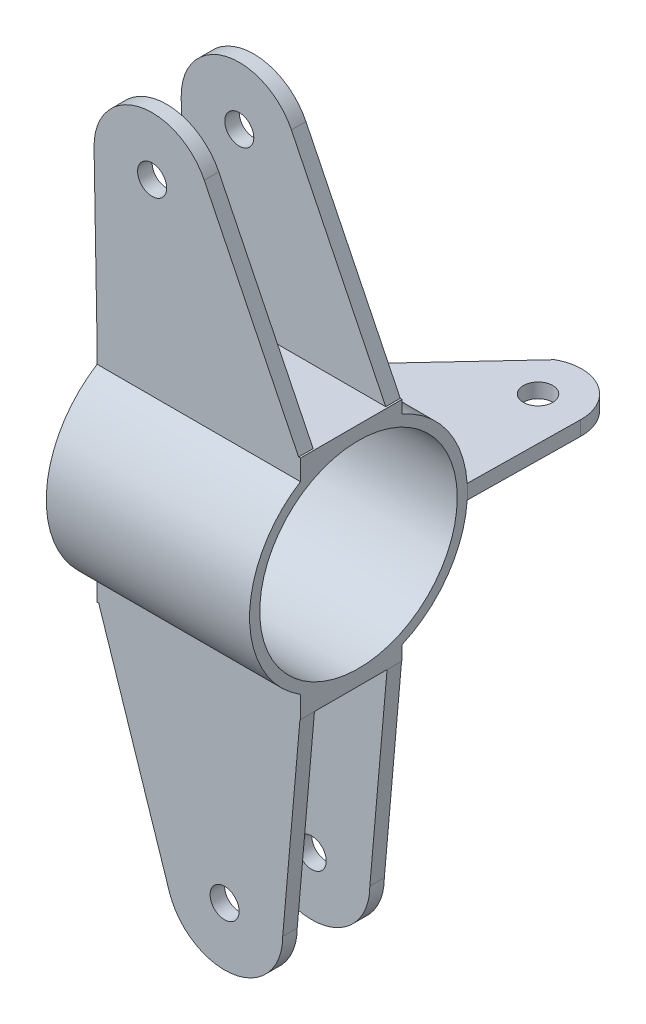
from build123d import *

# Parameters (mm, degrees)
SKETCH1_R             = 37.5
SKETCH1_R_2           = 34
BOSS_EXTRUDE1_DEPTH   = 35
BOSS_EXTRUDE2_START   = 15
SKETCH2_R             = 5
BOSS_EXTRUDE2_DEPTH   = 5
BOSS_EXTRUDE2_2_DEPTH = 5
BOSS_EXTRUDE3_START   = -15
SKETCH2_2_R           = 5
BOSS_EXTRUDE3_DEPTH   = 5
BOSS_EXTRUDE3_2_DEPTH = 5
BOSS_EXTRUDE4_DEPTH   = 70
BOSS_EXTRUDE5_START   = -70
BOSS_EXTRUDE5_DEPTH   = 70
SKETCH5_R             = 5.05
BOSS_EXTRUDE6_DEPTH   = 2.5
SKETCH6_W             = 0.149877485
SKETCH6_H             = 5
BOSS_EXTRUDE7_DEPTH   = 70


with BuildPart() as part:
    # Sketch1 → Boss-Extrude1 (new, symmetric)
    with BuildSketch(Plane(origin=(0, 0, 0), x_dir=(0, 0, -1), z_dir=(1, 0, 0))):
        Circle(SKETCH1_R)
        Circle(SKETCH1_R_2, mode=Mode.SUBTRACT)
    extrude(amount=BOSS_EXTRUDE1_DEPTH, both=True)



with BuildPart() as body_2:
    # Sketch2 → Boss-Extrude2 (new body)
    with BuildSketch(Plane.XY.offset(BOSS_EXTRUDE2_START)):
        with BuildLine():
            Line((-36.046360502, 95.880386994), (-35, 37.5))
            Line((-35, 37.5), (35, 37.5))
            Line((35, 37.5), (1.90425986, 105.037379634))
            ThreePointArc((1.90425986, 105.037379634), (-20.743145305, 115.677666176), (-36.046360502, 95.880386994))
        make_face()
        with Locations((-16.052783226, 96.238734902)):
            Circle(SKETCH2_R, mode=Mode.SUBTRACT)
    extrude(amount=BOSS_EXTRUDE2_DEPTH)


with BuildPart() as body_3:
    # Sketch2 → Boss-Extrude2 2 (new body)
    with BuildSketch(Plane.XY.offset(BOSS_EXTRUDE2_START)):
        with BuildLine():
            Line((-35, -37.5), (35, -37.5))
            Line((35, -37.5), (28.89703955, -106.961265098))
            ThreePointArc((28.89703955, -106.961265098), (12.060917272, -126.709426475), (-10.101948226, -113.209341881))
            Line((-10.101948226, -113.209341881), (-35, -37.5))
        make_face()
        with Locations((8.89703955, -106.961265098)):
            Circle(SKETCH2_R, mode=Mode.SUBTRACT)
    extrude(amount=BOSS_EXTRUDE2_2_DEPTH)


with BuildPart() as body_4:
    # Sketch2<2> → Boss-Extrude3 (new body)
    with BuildSketch(Plane.XY.offset(BOSS_EXTRUDE3_START)):
        with BuildLine():
            Line((-36.046360502, 95.880386994), (-35, 37.5))
            Line((-35, 37.5), (35, 37.5))
            Line((35, 37.5), (1.90425986, 105.037379634))
            ThreePointArc((1.90425986, 105.037379634), (-20.743145305, 115.677666176), (-36.046360502, 95.880386994))
        make_face()
        with Locations((-16.052783226, 96.238734902)):
            Circle(SKETCH2_2_R, mode=Mode.SUBTRACT)
    extrude(amount=BOSS_EXTRUDE3_DEPTH)


with BuildPart() as body_5:
    # Sketch2<2> → Boss-Extrude3 2 (new body)
    with BuildSketch(Plane.XY.offset(BOSS_EXTRUDE3_START)):
        with BuildLine():
            Line((-35, -37.5), (35, -37.5))
            Line((35, -37.5), (28.89703955, -106.961265098))
            ThreePointArc((28.89703955, -106.961265098), (12.060917272, -126.709426475), (-10.101948226, -113.209341881))
            Line((-10.101948226, -113.209341881), (-35, -37.5))
        make_face()
        with Locations((8.89703955, -106.961265098)):
            Circle(SKETCH2_2_R, mode=Mode.SUBTRACT)
    extrude(amount=BOSS_EXTRUDE3_2_DEPTH)


with BuildPart() as part_1:
    add(part.part)

    add(body_2.part)  # Boss-Extrude4 merges body 2

    add(body_4.part)  # Boss-Extrude4 merges body 4
    # Sketch3 → Boss-Extrude4 (add)
    with BuildSketch(Plane(origin=(35, 0, 0), x_dir=(0, 0, -1), z_dir=(1, 0, 0))):
        with BuildLine():
            Line((-20, 37.5), (-20, 31.721443851))
            ThreePointArc((-20, 31.721443851), (-2.828923646, 37.393143636), (15, 34.369317712))
            Line((15, 34.369317712), (15, 37.5))
            Line((15, 37.5), (15, 38.756727822))
            Line((15, 38.756727822), (-20, 38.756727822))
            Line((-20, 38.756727822), (-20, 37.5))
        make_face()
    extrude(amount=-BOSS_EXTRUDE4_DEPTH)


    add(body_3.part)  # Boss-Extrude5 merges body 3

    add(body_5.part)  # Boss-Extrude5 merges body 5
    # Sketch4 → Boss-Extrude5 (add)
    with BuildSketch(Plane.ZY.offset(35).offset(BOSS_EXTRUDE5_START)):
        with BuildLine():
            Line((-15, -39.232593617), (20, -39.232593617))
            Line((20, -39.232593617), (20, -31.721443851))
            ThreePointArc((20, -31.721443851), (2.828923646, -37.393143636), (-15, -34.369317712))
            Line((-15, -34.369317712), (-15, -39.232593617))
        make_face()
    extrude(amount=BOSS_EXTRUDE5_DEPTH)



with BuildPart() as body_2_2:
    # Sketch5 → Boss-Extrude6 (new, symmetric)
    with BuildSketch(Plane(origin=(0, 0, 0), x_dir=(1, 0, 0), z_dir=(0, 1, 0))):
        with BuildLine():
            Line((35, 37.5), (-35, 37.5))
            Line((-35, 37.5), (-35.078450863, 37.500626944))
            Line((-35.078450863, 37.500626944), (13.155155891, 89.33933901))
            ThreePointArc((13.155155891, 89.33933901), (28.276948524, 89.13371958), (35.534104179, 75.865540218))
            Line((35.534104179, 75.865540218), (35, 37.5))
        make_face()
        with Locations(Location((20.539917261, 76.283102971, 0), (0, 0, 270))):
            Circle(SKETCH5_R, mode=Mode.SUBTRACT)
    extrude(amount=BOSS_EXTRUDE6_DEPTH, both=True)


with BuildPart() as part_2:
    add(part_1.part)

    add(body_2_2.part)  # Boss-Extrude7 merges body 2 2
    # Sketch6 → Boss-Extrude7 (add)
    with BuildSketch(Plane(origin=(35, 0, 0), x_dir=(0, 0, -1), z_dir=(1, 0, 0))):
        with Locations((37.425061258, 0)):
            Rectangle(SKETCH6_W, SKETCH6_H)
    extrude(amount=-BOSS_EXTRUDE7_DEPTH)


solid = part_2.part
